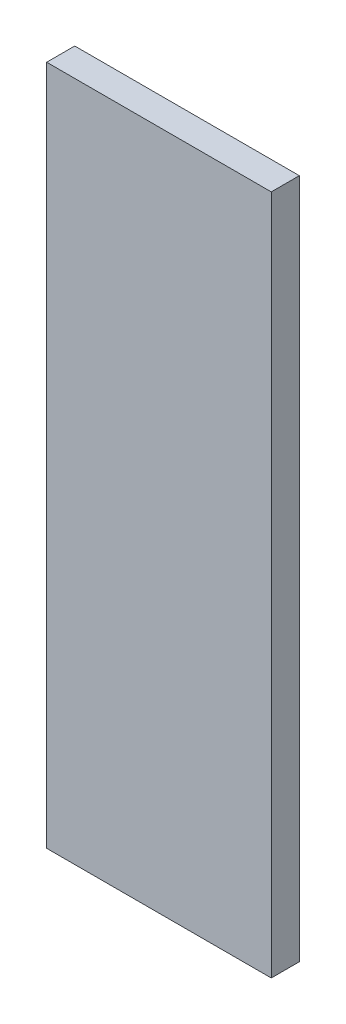
from build123d import *

# Parameters (mm, degrees)
SKETCH2_W           = 50.8
SKETCH2_H           = 153.9875
BOSS_EXTRUDE1_DEPTH = 6.35


with BuildPart() as part:
    # Sketch2 → Boss-Extrude1 (new body)
    with BuildSketch(Plane.XY):
        Rectangle(SKETCH2_W, SKETCH2_H)
    extrude(amount=BOSS_EXTRUDE1_DEPTH)


solid = part.part
